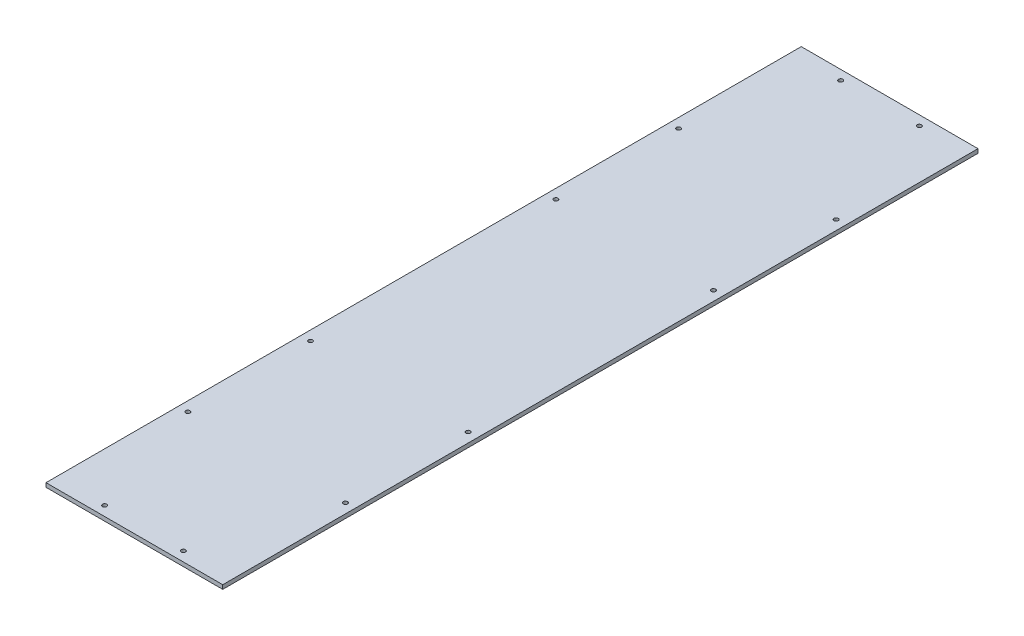
from build123d import *

# Parameters (mm, degrees)
SKETCH1_W           = 138.2
SKETCH1_H           = 590.55
SKETCH1_R           = 1.65
BOSS_EXTRUDE1_DEPTH = 3.175


with BuildPart() as part:
    # Sketch1 → Boss-Extrude1 (new body)
    with BuildSketch(Plane(origin=(0, 0, 0), x_dir=(1, 0, 0), z_dir=(0, 1, 0))):
        Rectangle(SKETCH1_W, SKETCH1_H)
        with Locations(Location((-30.8, 287.775, 0), (0, 0, 270))):
            Circle(SKETCH1_R, mode=Mode.SUBTRACT)
        with Locations(Location((-61.6, 191.848333333, 0), (0, 0, 270))):
            Circle(SKETCH1_R, mode=Mode.SUBTRACT)
        with Locations(Location((-61.6, 95.921666667, 0), (0, 0, 270))):
            Circle(SKETCH1_R, mode=Mode.SUBTRACT)
        with Locations(Location((61.6, 95.921666667, 0), (0, 0, 90))):
            Circle(SKETCH1_R, mode=Mode.SUBTRACT)
        with Locations(Location((61.6, 191.848333333, 0), (0, 0, 90))):
            Circle(SKETCH1_R, mode=Mode.SUBTRACT)
        with Locations(Location((30.8, 287.775, 0), (0, 0, 90))):
            Circle(SKETCH1_R, mode=Mode.SUBTRACT)
        with Locations(Location((30.8, -287.775, 0), (0, 0, 270))):
            Circle(SKETCH1_R, mode=Mode.SUBTRACT)
        with Locations(Location((61.6, -191.848333333, 0), (0, 0, 270))):
            Circle(SKETCH1_R, mode=Mode.SUBTRACT)
        with Locations(Location((61.6, -95.921666667, 0), (0, 0, 270))):
            Circle(SKETCH1_R, mode=Mode.SUBTRACT)
        with Locations(Location((-61.6, -95.921666667, 0), (0, 0, 90))):
            Circle(SKETCH1_R, mode=Mode.SUBTRACT)
        with Locations(Location((-61.6, -191.848333333, 0), (0, 0, 90))):
            Circle(SKETCH1_R, mode=Mode.SUBTRACT)
        with Locations(Location((-30.8, -287.775, 0), (0, 0, 90))):
            Circle(SKETCH1_R, mode=Mode.SUBTRACT)
    extrude(amount=BOSS_EXTRUDE1_DEPTH)


solid = part.part
